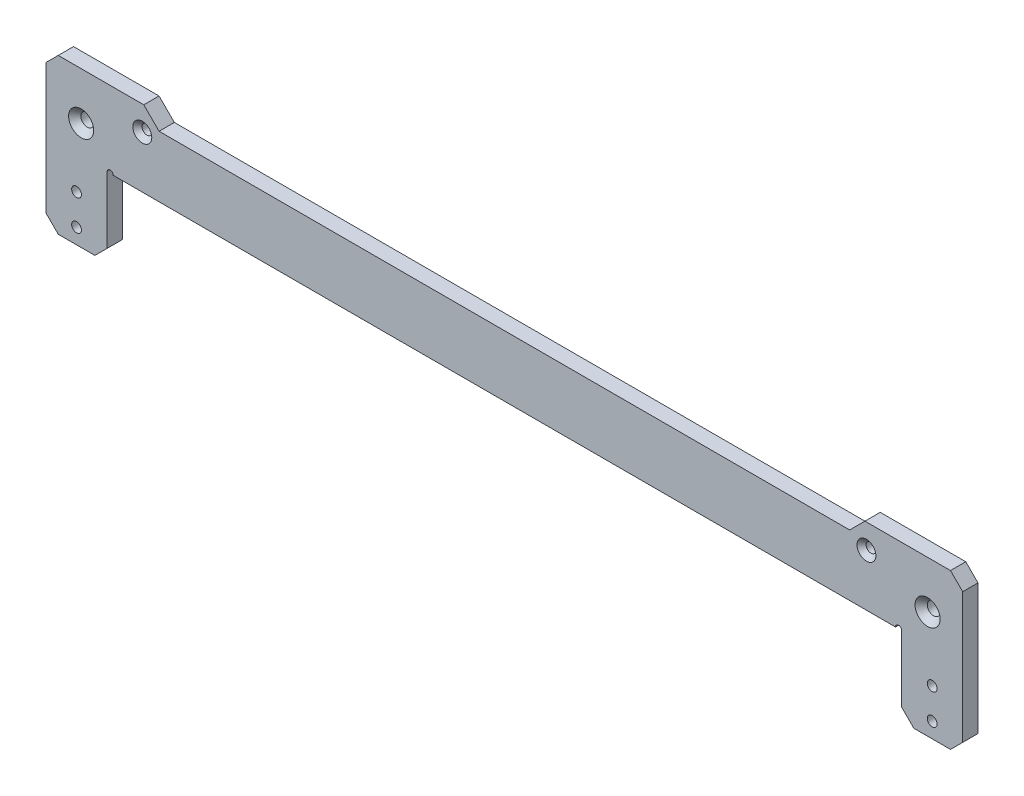
from build123d import *

# Parameters (mm, degrees)
SKETCH_1_R          = 1.6
EXTRUDE_1_DEPTH     = 2.5
CUT_EXTRUDE_2_DEPTH = 156.503987087
CHAMFER_2_SIZE      = 4
SKETCH_6_R          = 1
CUT_EXTRUDE_3_DEPTH = 156.503987087
SKETCH_7_R          = 2.1
SKETCH_7_R_2        = 1.6
CUT_EXTRUDE_4_DEPTH = 156.503987087
CHAMFER_3_SIZE      = 1.5
CHAMFER_4_SIZE      = 2


with BuildPart() as part:
    # 草图1 → 凸台-拉伸1 (new, symmetric)
    with BuildSketch(Plane.XY):
        Polygon((-150, 40.7), (-150, -10), (-130, -10), (-130, 15.7), (130, 15.7), (130, -10), (150, -10), (150, 40.7), align=None)
        with Locations((-140, 5)):
            Circle(SKETCH_1_R, mode=Mode.SUBTRACT)
        with Locations((-140, -5)):
            Circle(SKETCH_1_R, mode=Mode.SUBTRACT)
        with Locations((140, 5)):
            Circle(SKETCH_1_R, mode=Mode.SUBTRACT)
        with Locations((140, -5)):
            Circle(SKETCH_1_R, mode=Mode.SUBTRACT)
    extrude(amount=EXTRUDE_1_DEPTH, both=True)

    # 草图4 → 切除-拉伸2 (cut, through all)
    with BuildSketch(Plane.XY.offset(2.5)):
        Polygon((118, 40.7), (113, 35.7), (-113, 35.7), (-118, 40.7), align=None)
    extrude(amount=-CUT_EXTRUDE_2_DEPTH, mode=Mode.SUBTRACT)

    # 倒角2
    chamfer_2_edges = [part.edges().sort_by_distance(p)[0] for p in [
        (-150, -10, 0),
        (-150, 40.7, 0),
        (150, 40.7, 0),
        (150, -10, 0),
        (130, -10, 0),
        (-130, -10, 0),
    ]]
    chamfer(chamfer_2_edges, length=CHAMFER_2_SIZE)

    # 草图6 → 切除-拉伸3 (cut, through all)
    with BuildSketch(Plane(origin=(0, 0, -2.5), x_dir=(-1, 0, 0), z_dir=(0, 0, -1))):
        with Locations((129, 15.7)):
            Circle(SKETCH_6_R)
        with Locations((-129, 15.7)):
            Circle(SKETCH_6_R)
    extrude(amount=-CUT_EXTRUDE_3_DEPTH, mode=Mode.SUBTRACT)

    # 草图7 → 切除-拉伸4 (cut, through all)
    with BuildSketch(Plane.XY.offset(2.5)):
        with Locations((-138.5, 25.2)):
            Circle(SKETCH_7_R)
        with Locations((118.485281374, 32.7)):
            Circle(SKETCH_7_R_2)
        with Locations((-118.485281374, 32.7)):
            Circle(SKETCH_7_R_2)
        with Locations(Location((138.5, 25.2, 0), (0, 0, 180))):
            Circle(SKETCH_7_R)
    extrude(amount=-CUT_EXTRUDE_4_DEPTH, mode=Mode.SUBTRACT)

    # 倒角3
    chamfer_3_edges = [part.edges().sort_by_distance(p)[0] for p in [
        (116.885281374, 32.7, 2.5),
        (-120.085281374, 32.7, 2.5),
    ]]
    chamfer(chamfer_3_edges, length=CHAMFER_3_SIZE)

    # 倒角4
    chamfer_4_edges = [part.edges().sort_by_distance(p)[0] for p in [
        (-140.6, 25.2, 2.5),
        (140.6, 25.2, 2.5),
    ]]
    chamfer(chamfer_4_edges, length=CHAMFER_4_SIZE)


solid = part.part
